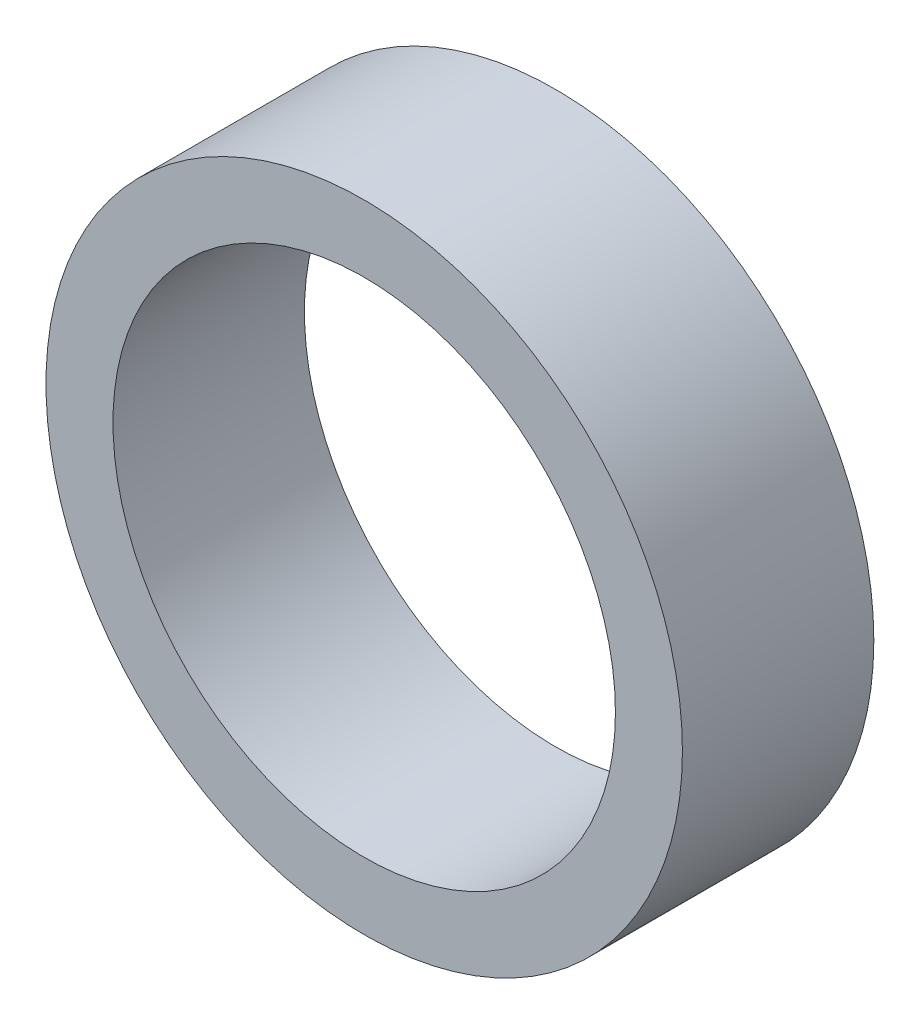
from build123d import *

# Parameters (mm, degrees)
BOSS_EXTRUDE1_START = 5
SKETCH1_R           = 3.325
SKETCH1_R_2         = 2.625
BOSS_EXTRUDE1_DEPTH = 2


with BuildPart() as part:
    # Sketch1 → Boss-Extrude1 (new body)
    with BuildSketch(Plane.XY.offset(3).offset(BOSS_EXTRUDE1_START)):
        with Locations((33, 0)):
            Circle(SKETCH1_R)
        with Locations((33, 0)):
            Circle(SKETCH1_R_2, mode=Mode.SUBTRACT)
    extrude(amount=BOSS_EXTRUDE1_DEPTH)


solid = part.part
